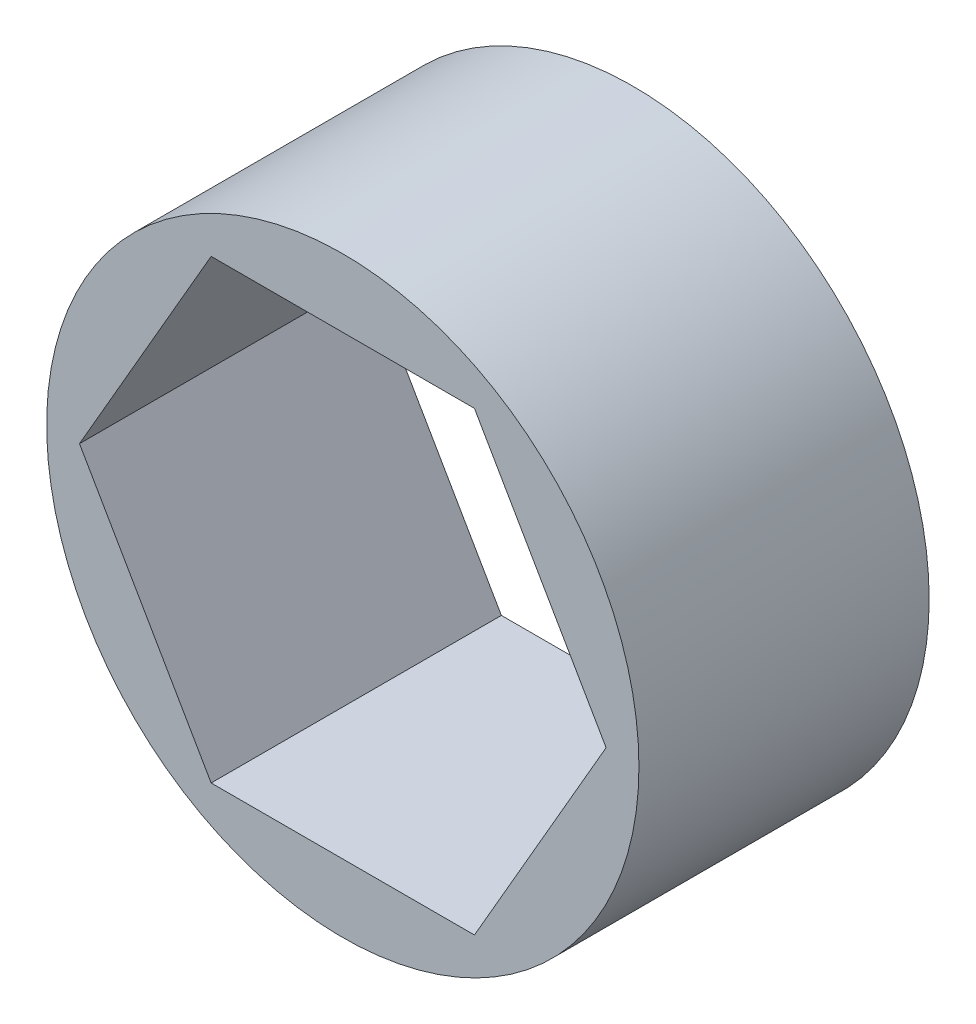
from build123d import *

# Parameters (mm, degrees)
SKETCH1_R           = 6.35
BOSS_EXTRUDE1_DEPTH = 6.223


with BuildPart() as part:
    # Sketch1 → Boss-Extrude1 (new body)
    with BuildSketch(Plane.XY):
        Circle(SKETCH1_R)
        Polygon((5.645908282, 0), (2.822954141, 4.8895), (-2.822954141, 4.8895), (-5.645908282, 0), (-2.822954141, -4.8895), (2.822954141, -4.8895), align=None, mode=Mode.SUBTRACT)
    extrude(amount=BOSS_EXTRUDE1_DEPTH)


solid = part.part
